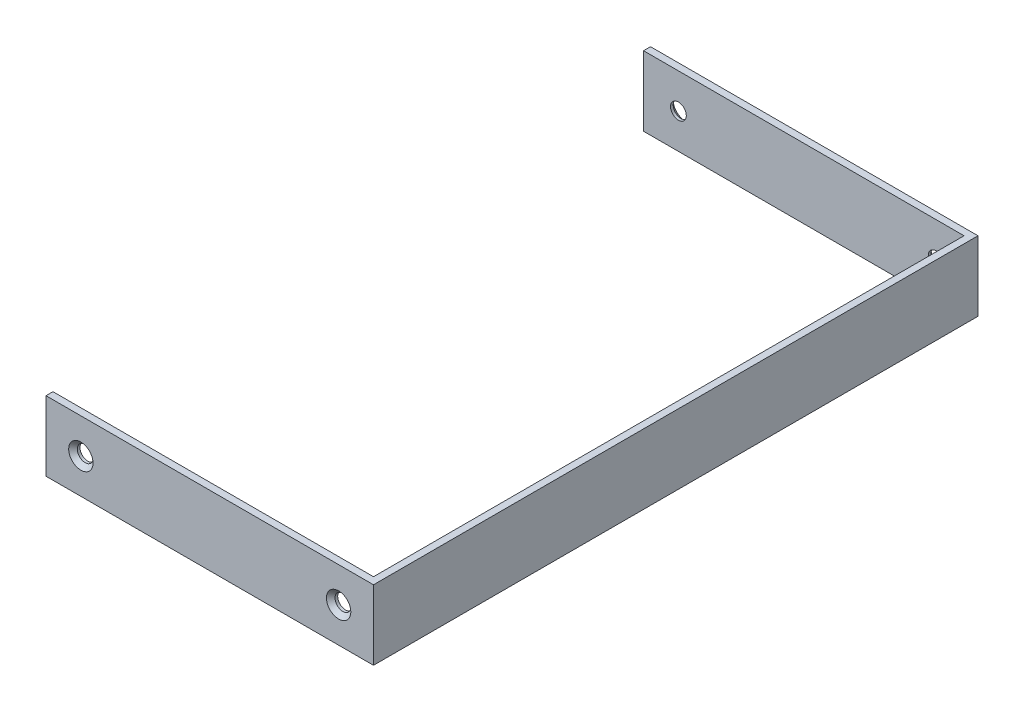
from build123d import *

# Parameters (mm, degrees)
SKETCH3_W                       = 89.4306822
SKETCH3_H                       = 19.05
BOSS_EXTRUDE1_DEPTH             = 82.538333314
SKETCH4_W                       = 87.5256822
SKETCH4_H                       = 161.266666628
CUT_EXTRUDE1_DEPTH              = 96.785910738
F_6_CLEARANCE_HOLE1_AT_2_COUNT  = 2
F_6_CLEARANCE_HOLE1_AT_2_PITCH  = 70.3806822
F_6_CLEARANCE_HOLE2_D           = 4.3053
F_6_CLEARANCE_HOLE2_DEPTH       = 6.858
F_6_CLEARANCE_HOLE2_CSINK_D     = 6.6548
F_6_CLEARANCE_HOLE2_CSINK_ANGLE = 90
F_6_CLEARANCE_HOLE2_TIP         = 1.293442612


with BuildPart() as part:
    # Sketch3 → Boss-Extrude1 (new, symmetric)
    with BuildSketch(Plane.XY):
        Rectangle(SKETCH3_W, SKETCH3_H)
    extrude(amount=BOSS_EXTRUDE1_DEPTH, both=True)

    # Sketch4 → Cut-Extrude1 (cut, through all)
    with BuildSketch(Plane.XZ.offset(9.525)):
        with Locations((-0.9525, 0)):
            Rectangle(SKETCH4_W, SKETCH4_H)
    extrude(amount=-CUT_EXTRUDE1_DEPTH, mode=Mode.SUBTRACT)

    # Sketch6 → #6 Clearance Hole1 (revolve, cut)
    with BuildSketch(Plane(origin=(35.1903411, 0, -82.538333314), x_dir=(0, 1, 0), z_dir=(1, 0, 0))):
        Polygon((0, 0), (0, 1.905), (2.15265, 1.905), (2.15265, 1.17475), (3.3274, 0), align=None)
    f_6_clearance_hole1 = revolve(axis=Axis((35.1903411, 0, -88.888333314), (0, 0, 1)), mode=Mode.SUBTRACT)

    # #6 Clearance Hole1 at 2: #6 Clearance Hole1 ×2
    with Locations(*[(-i * F_6_CLEARANCE_HOLE1_AT_2_PITCH, 0, 0) for i in range(1, F_6_CLEARANCE_HOLE1_AT_2_COUNT)]):
        add(f_6_clearance_hole1, mode=Mode.SUBTRACT)

    # #6 Clearance Hole2
    with Locations(Plane.XY.offset(82.538333314)):
        with Locations((-35.1903411, 0), (35.1903411, 0)):
            CounterSinkHole(F_6_CLEARANCE_HOLE2_D / 2, F_6_CLEARANCE_HOLE2_CSINK_D / 2, depth=F_6_CLEARANCE_HOLE2_DEPTH, counter_sink_angle=F_6_CLEARANCE_HOLE2_CSINK_ANGLE)
            with Locations((0, 0, -(F_6_CLEARANCE_HOLE2_DEPTH + F_6_CLEARANCE_HOLE2_TIP / 2))):  # 118° drill point
                Cone(0, F_6_CLEARANCE_HOLE2_D / 2, F_6_CLEARANCE_HOLE2_TIP, mode=Mode.SUBTRACT)


solid = part.part
